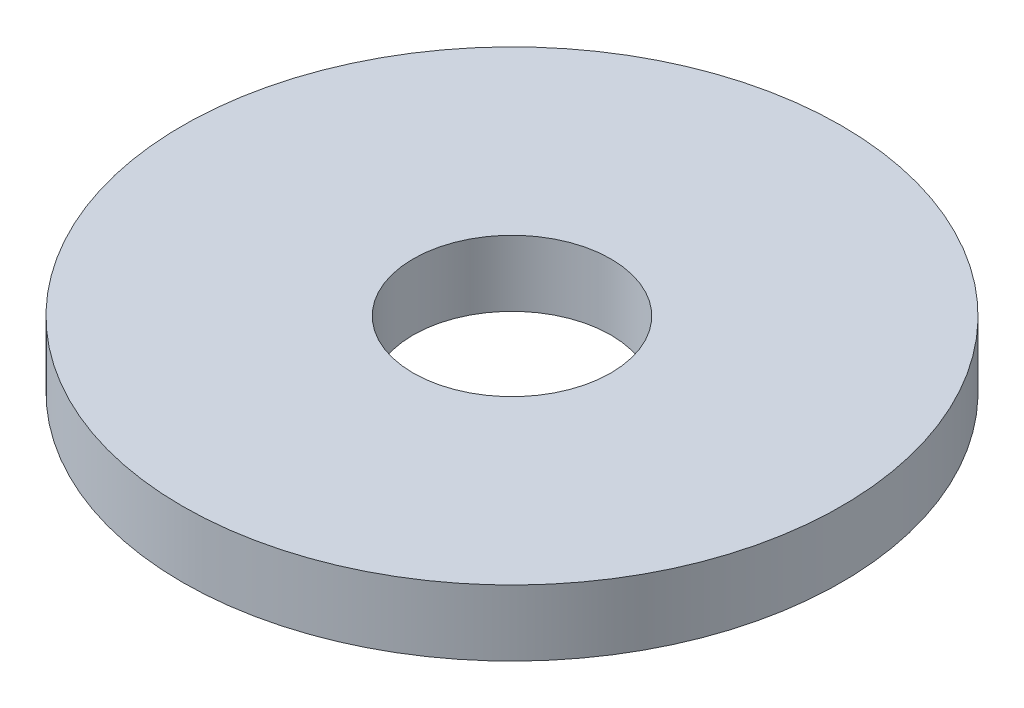
from build123d import *

# Parameters (mm, degrees)
SKETCH1_R           = 5
SKETCH1_R_2         = 1.5
BOSS_EXTRUDE1_DEPTH = 1


with BuildPart() as part:
    # Sketch1 → Boss-Extrude1 (new body)
    with BuildSketch(Plane(origin=(0, 0, 0), x_dir=(1, 0, 0), z_dir=(0, 1, 0))):
        with Locations(Location((12.868646323, -5, 0), (0, 0, 270))):
            Circle(SKETCH1_R)
        with Locations(Location((12.868646323, -5, 0), (0, 0, 270))):
            Circle(SKETCH1_R_2, mode=Mode.SUBTRACT)
    extrude(amount=BOSS_EXTRUDE1_DEPTH)


solid = part.part
